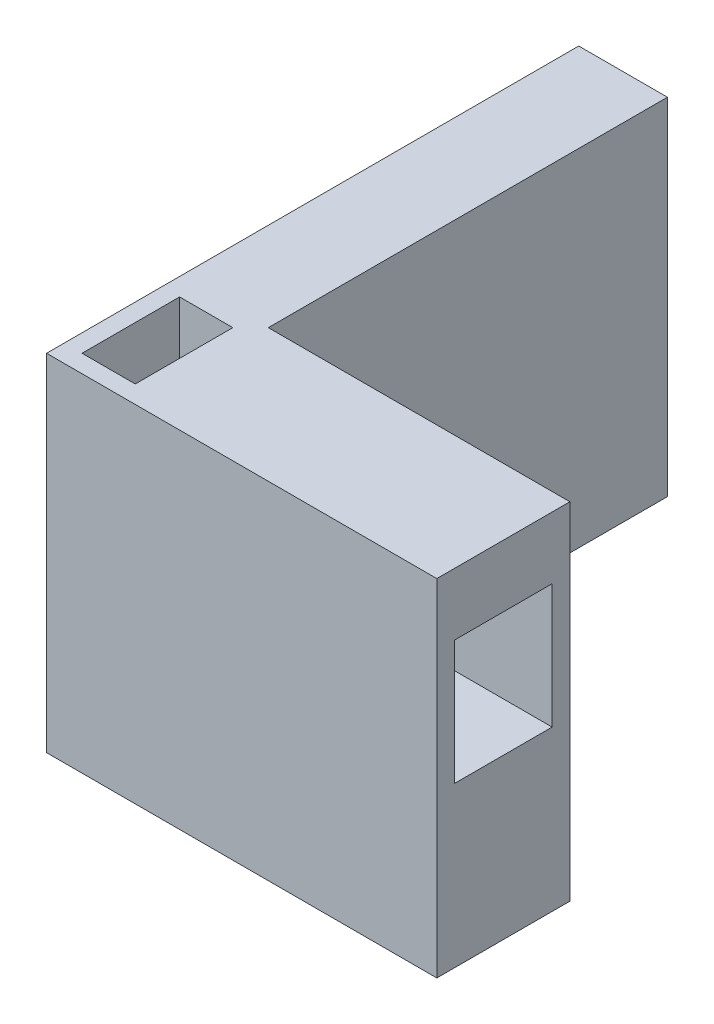
from build123d import *

# Parameters (mm, degrees)
BOSS_EXTRUDE5_DEPTH = 390
SKETCH7_R           = 30
CUT_EXTRUDE4_DEPTH  = 120
SKETCH10_W          = 110
SKETCH10_H          = 140
CUT_EXTRUDE6_DEPTH  = 841.059521701
CUT_EXTRUDE9_START  = -390
SKETCH13_W          = 30
SKETCH13_H          = 110
CUT_EXTRUDE9_DEPTH  = 390
SKETCH15_W          = 60
SKETCH15_H          = 60
CUT_EXTRUDE10_DEPTH = 470


with BuildPart() as part:
    # Sketch1 → Boss-Extrude5 (new body)
    with BuildSketch(Plane(origin=(0, 0, 0), x_dir=(1, 0, 0), z_dir=(0, 1, 0))):
        Polygon((0, 0), (440, 0), (440, 150), (100, 150), (100, 600), (0, 600), align=None)
    extrude(amount=BOSS_EXTRUDE5_DEPTH)

    # Sketch7 → Cut-Extrude4 (cut)
    with BuildSketch(Plane(origin=(0, 0, -150), x_dir=(-1, 0, 0), z_dir=(0, 0, -1))):
        with Locations((-190, 250)):
            Circle(SKETCH7_R)
    extrude(amount=-CUT_EXTRUDE4_DEPTH, mode=Mode.SUBTRACT)

    # Sketch10 → Cut-Extrude6 (cut, through all)
    with BuildSketch(Plane(origin=(440, 0, 0), x_dir=(0, 0, -1), z_dir=(1, 0, 0))):
        with Locations((75, 250)):
            Rectangle(SKETCH10_W, SKETCH10_H)
    extrude(amount=-CUT_EXTRUDE6_DEPTH, mode=Mode.SUBTRACT)

    # Sketch13 → Cut-Extrude9 (cut)
    with BuildSketch(Plane.XZ.offset(CUT_EXTRUDE9_START)):
        with Locations((65, -75)):
            Rectangle(SKETCH13_W, SKETCH13_H)
        with Locations((35, -75)):
            Rectangle(SKETCH13_W, SKETCH13_H)
    extrude(amount=CUT_EXTRUDE9_DEPTH, mode=Mode.SUBTRACT)

    # Sketch15 → Cut-Extrude10 (cut)
    with BuildSketch(Plane(origin=(0, 0, -600), x_dir=(-1, 0, 0), z_dir=(0, 0, -1))):
        with Locations((-50, 250)):
            Rectangle(SKETCH15_W, SKETCH15_H)
    extrude(amount=-CUT_EXTRUDE10_DEPTH, mode=Mode.SUBTRACT)


solid = part.part
